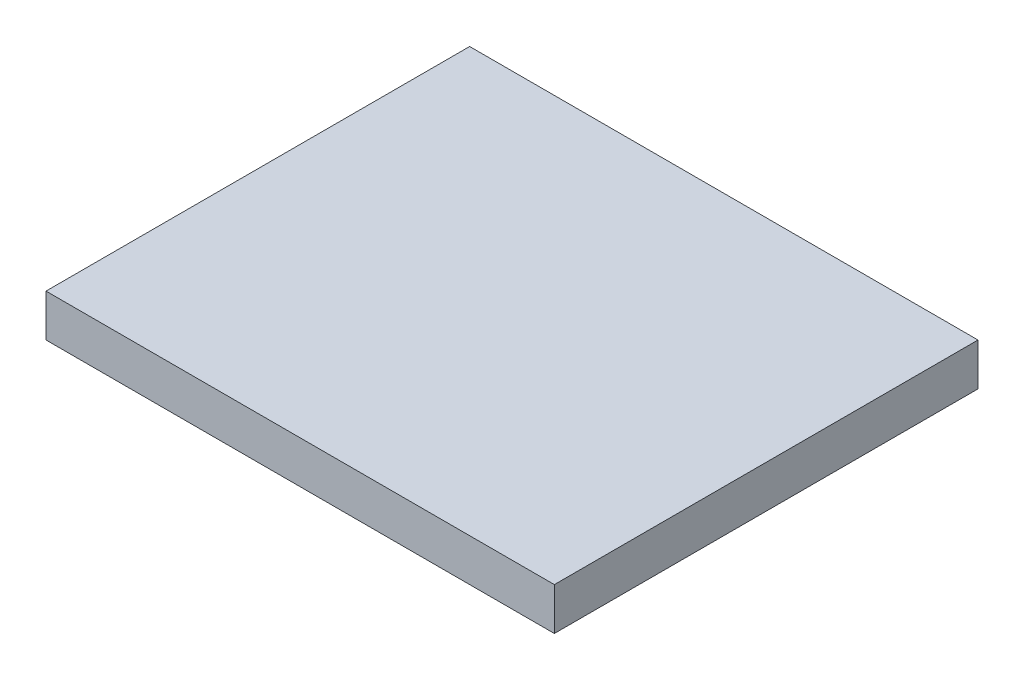
from build123d import *

# Parameters (mm, degrees)
SKETCH1_W           = 120
SKETCH1_H           = 100
BOSS_EXTRUDE1_DEPTH = 10


with BuildPart() as part:
    # Sketch1 → Boss-Extrude1 (new body)
    with BuildSketch(Plane(origin=(0, 0, 0), x_dir=(1, 0, 0), z_dir=(0, 1, 0))):
        Rectangle(SKETCH1_W, SKETCH1_H)
    extrude(amount=BOSS_EXTRUDE1_DEPTH)


solid = part.part
